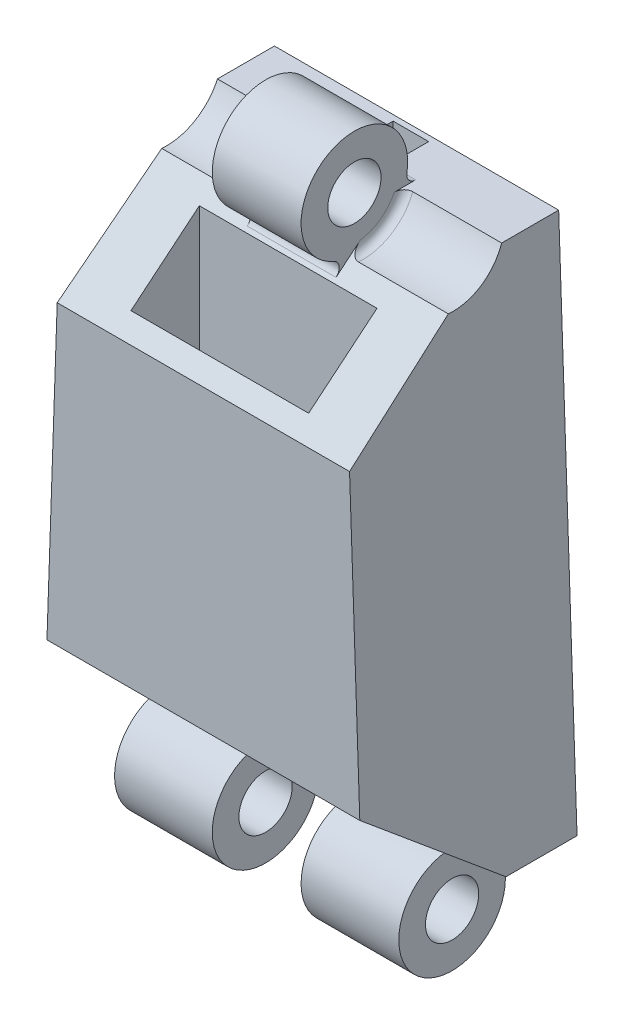
from build123d import *

# Parameters (mm, degrees)
BOSS_EXTRUDE2_DEPTH            = 12
CUT_EXTRUDE2_DEPTH             = 22.571014648492383
CUT_EXTRUDE2_DEPTH_BACK        = 22.571014648492383
SKETCH17_R                     = 3.0000000000000298
SKETCH17_R_2                   = 1.5
BOSS_EXTRUDE3_DEPTH            = 2.5
CUT_EXTRUDE3_DEPTH             = 25.679395227729078
CUT_EXTRUDE3_DEPTH_BACK        = 25.679395227729078
SKETCH19_R                     = 1.4999999999999996
BOSS_EXTRUDE4_DEPTH            = 8
SKETCH19_3_R                   = 3.0000000000000004
CUT_EXTRUDE4_DEPTH             = 2.5
CUT_EXTRUDE5_START             = 10
SKETCH20_R                     = 2.9999999999999996
CUT_EXTRUDE5_DEPTH             = 10
SKETCH21_R                     = 2.999999999999999
CUT_EXTRUDE6_DEPTH             = 10
FILLET6_R                      = 0.5000000000000004
FILLET7_R                      = 0.5000000000000004
FILLET8_R                      = 0.5000000000000004
CUT_EXTRUDE7_REACH             = 27.076
CUT_EXTRUDE7_DIRECTION_2_REACH = 27.076
CUT_EXTRUDE8_DEPTH             = 1


with BuildPart() as part:
    # Sketch1 → Boss-Extrude2 (new body)
    with BuildSketch(Plane.XY):
        Polygon((-7.999999999999995, -14.500000000000002), (-6.966131724806635, 15.482179980607619), (9.033868275193369, 15.482179980607619), (10.067736550386755, -14.500000000000002), align=None)
    extrude(amount=BOSS_EXTRUDE2_DEPTH)

    # Sketch16 → Cut-Extrude2 (cut, two sides: drawn at the far end of the back side and taken through both)
    with BuildSketch(Plane(origin=(1.0338682751933665, 0, 0), x_dir=(0, 0, -1), z_dir=(1, 0, 0)).offset(-CUT_EXTRUDE2_DEPTH_BACK)):
        Polygon((-12, 8.852541981440545), (-4, 15.482179980607619), (-12, 15.482179980607619), align=None)
    extrude(amount=CUT_EXTRUDE2_DEPTH + CUT_EXTRUDE2_DEPTH_BACK, mode=Mode.SUBTRACT)

    # Sketch17 → Boss-Extrude3 (add, symmetric)
    with BuildSketch(Plane(origin=(1.0338682751933665, 0, 0), x_dir=(0, 0, -1), z_dir=(1, 0, 0))):
        with Locations((-6.000000000000029, 16.582179980607627)):
            Circle(SKETCH17_R)
        with Locations((-6.000000000000001, 16.58217998060762)):
            Circle(SKETCH17_R_2, mode=Mode.SUBTRACT)
    extrude(amount=BOSS_EXTRUDE3_DEPTH, both=True)

    # Sketch18 → Cut-Extrude3 (cut, two sides: drawn at the far end of the back side and taken through both)
    with BuildSketch(Plane(origin=(1.0338682751933665, 0, 0), x_dir=(0, 0, -1), z_dir=(1, 0, 0)).offset(-CUT_EXTRUDE3_DEPTH_BACK)):
        Polygon((-12, -14.500000000000002), (-4, -14.500000000000002), (-12, -7.870362000832929), align=None)
    extrude(amount=CUT_EXTRUDE3_DEPTH + CUT_EXTRUDE3_DEPTH_BACK, mode=Mode.SUBTRACT)

    # Sketch19 → Boss-Extrude4 (add, symmetric)
    with BuildSketch(Plane(origin=(1.0338682751933665, 0, 0), x_dir=(0, 0, -1), z_dir=(1, 0, 0))):
        with BuildLine():
            ThreePointArc((-8.791057147390573, -14.500000000000002), (-6.5598341530436866, -18.547301430306355), (-2.9999999999999996, -15.600000000000003))
            ThreePointArc((-2.9999999999999996, -15.600000000000003), (-3.0526985696936495, -15.040165846956317), (-3.2089428526094275, -14.500000000000002))
            ThreePointArc((-3.2089428526094275, -14.500000000000002), (-6, -12.600000000000003), (-8.791057147390573, -14.500000000000002))
        make_face()
        with Locations((-6, -15.600000000000003)):
            Circle(SKETCH19_R, mode=Mode.SUBTRACT)
    extrude(amount=BOSS_EXTRUDE4_DEPTH, both=True)

    # Sketch19<3> → Cut-Extrude4 (cut, symmetric)
    with BuildSketch(Plane(origin=(1.0338682751933665, 0, 0), x_dir=(0, 0, -1), z_dir=(1, 0, 0))):
        with Locations((-6, -15.600000000000003)):
            Circle(SKETCH19_3_R)
    extrude(amount=CUT_EXTRUDE4_DEPTH, both=True, mode=Mode.SUBTRACT)

    # Sketch20 → Cut-Extrude5 (cut)
    with BuildSketch(Plane(origin=(3.5338682751933668, 0, 0), x_dir=(0, 0, -1), z_dir=(1, 0, 0)).offset(CUT_EXTRUDE5_START)):
        with Locations((-6, 16.58217998060762)):
            Circle(SKETCH20_R)
    extrude(amount=-CUT_EXTRUDE5_DEPTH, mode=Mode.SUBTRACT)

    # Sketch21 → Cut-Extrude6 (cut)
    with BuildSketch(Plane.ZY.offset(1.4661317248066335)):
        with Locations((6, 16.58217998060762)):
            Circle(SKETCH21_R)
    extrude(amount=CUT_EXTRUDE6_DEPTH, mode=Mode.SUBTRACT)

    # Fillet6
    fillet6_edges = [part.edges().sort_by_distance(p)[0] for p in [
        (1.0338682751933665, 13.59501804601977, 6.277242811538059),
    ]]
    fillet(fillet6_edges, radius=FILLET6_R)

    # Fillet7
    fillet7_edges = [part.edges().sort_by_distance(p)[0] for p in [
        (1.0338682751933665, 15.482179980607619, 3.208942852609428),
    ]]
    fillet(fillet7_edges, radius=FILLET7_R)

    # Fillet8
    fillet8_edges = [part.edges().sort_by_distance(p)[0] for p in [
        (3.5338682751933668, 14.026824950601753, 4.428325520146199),
        (-1.4661317248066335, 14.026824950601755, 4.428325520146199),
    ]]
    fillet(fillet8_edges, radius=FILLET8_R)

    # Cut-Extrude7: up to this plane
    cut_extrude7_end = Plane(origin=(-7.999999999999995, -10.561614048947142, 8.752459728929596), z_dir=(0, 0.769971126082772, -0.6380787294674758))
    # Sketch24 → Cut-Extrude7 (cut, up to the surface)
    with BuildSketch(Plane(origin=(0, 0, 0), x_dir=(1, 0, 0), z_dir=(0, 1, 0)), mode=Mode.PRIVATE) as cut_extrude7_sk1:
        Polygon((-3.966131724806632, -7.226179018286816), (-3.966131724806632, -11.076034648700675), (6.0338682751933685, -11.076034648700674), (6.0338682751933685, -7.226179018286816), align=None)
    cut_extrude7_tool1 = split(extrude(cut_extrude7_sk1.sketch, amount=-CUT_EXTRUDE7_REACH, mode=Mode.PRIVATE), bisect_by=cut_extrude7_end, keep=Keep.BOTH, mode=Mode.PRIVATE)
    add(cut_extrude7_tool1.solids().sort_by_distance((1.033868, 0, 9.151107))[0], mode=Mode.SUBTRACT)

    # Cut-Extrude7 direction 2: up to this plane
    cut_extrude7_direction_2_end = Plane(origin=(-7.999999999999995, 11.14390488681771, 9.23500691209379), z_dir=(0, 0.769971126082772, 0.6380787294674758))
    # Sketch24 → Cut-Extrude7 direction 2 (cut, up to the surface)
    with BuildSketch(Plane(origin=(0, 0, 0), x_dir=(1, 0, 0), z_dir=(0, 1, 0)), mode=Mode.PRIVATE) as cut_extrude7_direction_2_sk1:
        Polygon((-3.966131724806632, -7.226179018286816), (-3.966131724806632, -11.076034648700675), (6.0338682751933685, -11.076034648700674), (6.0338682751933685, -7.226179018286816), align=None)
    cut_extrude7_direction_2_tool1 = split(extrude(cut_extrude7_direction_2_sk1.sketch, amount=CUT_EXTRUDE7_DIRECTION_2_REACH, mode=Mode.PRIVATE), bisect_by=cut_extrude7_direction_2_end, keep=Keep.BOTH, mode=Mode.PRIVATE)
    add(cut_extrude7_direction_2_tool1.solids().sort_by_distance((1.033868, 0, 9.151107))[0], mode=Mode.SUBTRACT)

    # Sketch25 → Cut-Extrude8 (cut, symmetric)
    with BuildSketch(Plane(origin=(1.0338682751933665, 0, 0), x_dir=(0, 0, -1), z_dir=(1, 0, 0))):
        Polygon((-2.32, -14.500000000000002), (-0.31999999999999995, -14.500000000000002), (-0.31999999999999995, -14.381743641915115), (-0.31999999999999995, 15.883160410365697), (-2.32, 15.883160410365697), (-2.32, -14.381743641915115), align=None)
    extrude(amount=CUT_EXTRUDE8_DEPTH, both=True, mode=Mode.SUBTRACT)


solid = part.part
